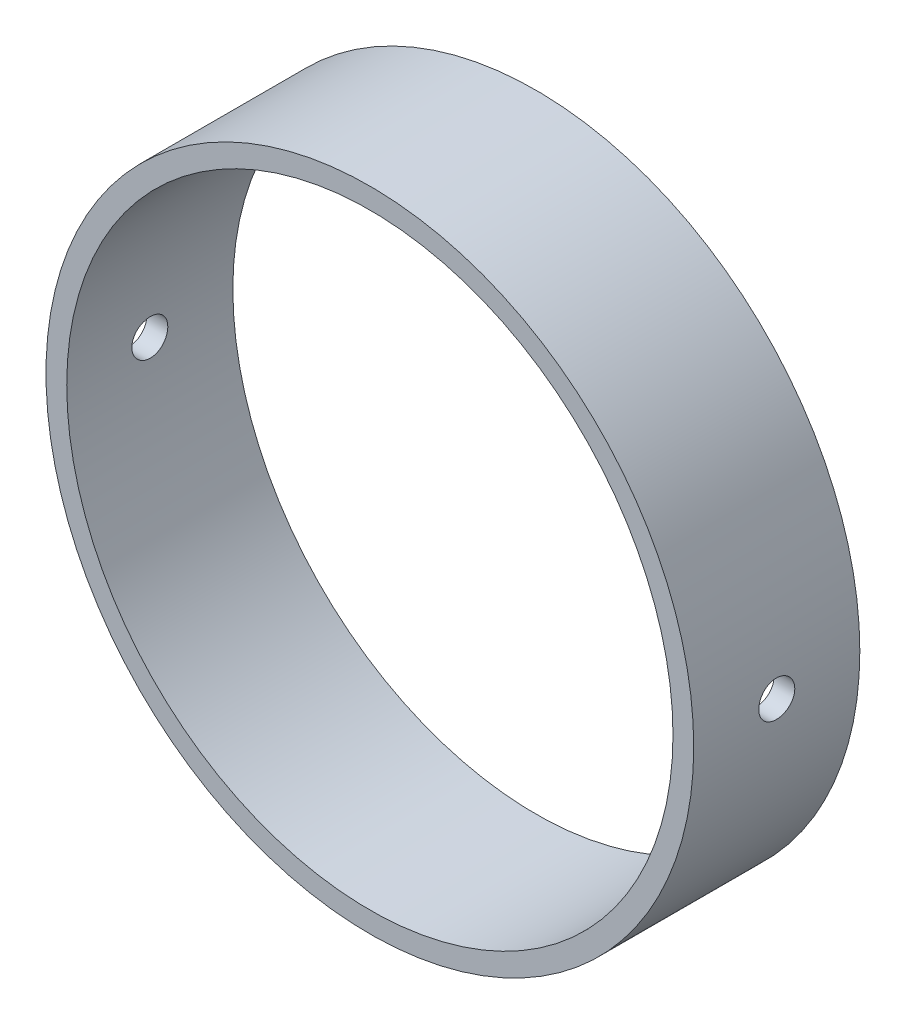
from build123d import *

# Parameters (mm, degrees)
SKETCH1_R               = 58.5
SKETCH1_R_2             = 54.75
BOSS_EXTRUDE1_DEPTH     = 30
CUT_EXTRUDE1_DEPTH      = 89.002840863
CUT_EXTRUDE1_DEPTH_BACK = 89.002840863
SKETCH2_R               = 3.25


with BuildPart() as part:
    # Sketch1 → Boss-Extrude1 (new body)
    with BuildSketch(Plane.XY):
        Circle(SKETCH1_R)
        Circle(SKETCH1_R_2, mode=Mode.SUBTRACT)
    extrude(amount=BOSS_EXTRUDE1_DEPTH)

    # Sketch2 → Cut-Extrude1 (cut, two sides: drawn at the far end of the back side and taken through both)
    with BuildSketch(Plane(origin=(0, 0, 0), x_dir=(0, 0, -1), z_dir=(1, 0, 0)).offset(-CUT_EXTRUDE1_DEPTH_BACK)):
        with Locations((-15, 0)):
            Circle(SKETCH2_R)
    extrude(amount=CUT_EXTRUDE1_DEPTH + CUT_EXTRUDE1_DEPTH_BACK, mode=Mode.SUBTRACT)


solid = part.part
